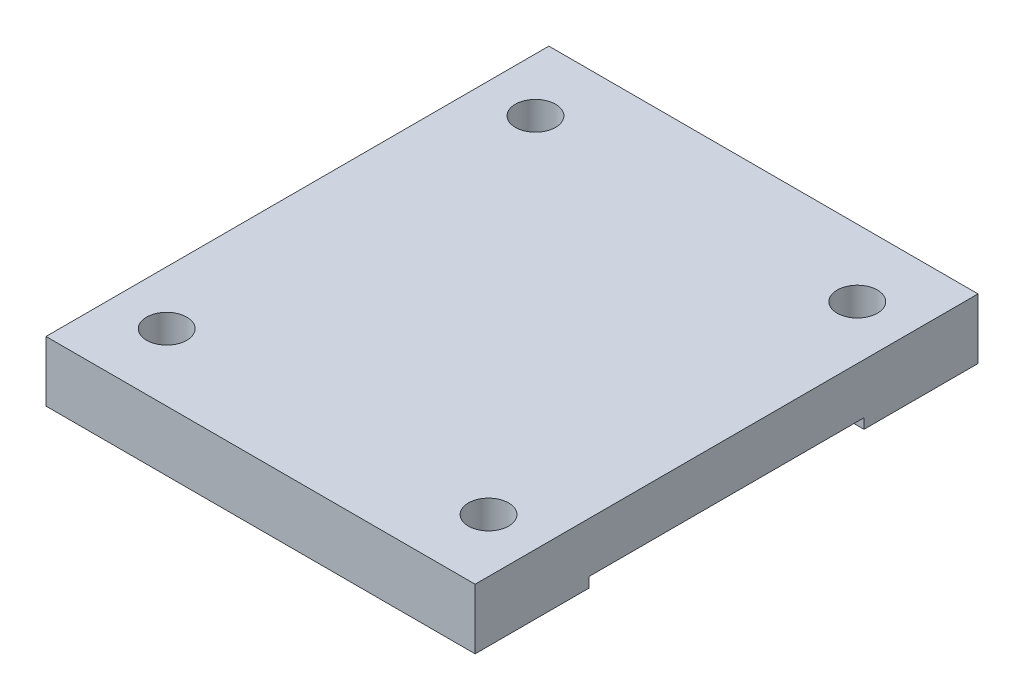
from build123d import *

# Parameters (mm, degrees)
SKETCH1_W                = 64
SKETCH1_H                = 75
BOSS_EXTRUDE1_DEPTH      = 9
SKETCH2_W                = 64
SKETCH2_H                = 41
CUT_EXTRUDE1_DEPTH       = 1.5
F_6_0_6_DIAMETER_HOLE1_D = 6


with BuildPart() as part:
    # Sketch1 → Boss-Extrude1 (new body)
    with BuildSketch(Plane(origin=(0, 0, 0), x_dir=(1, 0, 0), z_dir=(0, 1, 0))):
        with Locations((32, 0)):
            Rectangle(SKETCH1_W, SKETCH1_H)
    extrude(amount=BOSS_EXTRUDE1_DEPTH)

    # Sketch2 → Cut-Extrude1 (cut)
    with BuildSketch(Plane.XZ):
        with Locations((32, 0)):
            Rectangle(SKETCH2_W, SKETCH2_H)
    extrude(amount=-CUT_EXTRUDE1_DEPTH, mode=Mode.SUBTRACT)

    # Ø6.0 (6) Diameter Hole1 (through all)
    with Locations(Plane(origin=(0, 9, 0), x_dir=(-1, 0, 0), z_dir=(0, 1, 0))):
        with Locations((-8, 27.5), (-8, -27.5), (-56, -27.5), (-56, 27.5)):
            Hole(F_6_0_6_DIAMETER_HOLE1_D / 2)


solid = part.part
